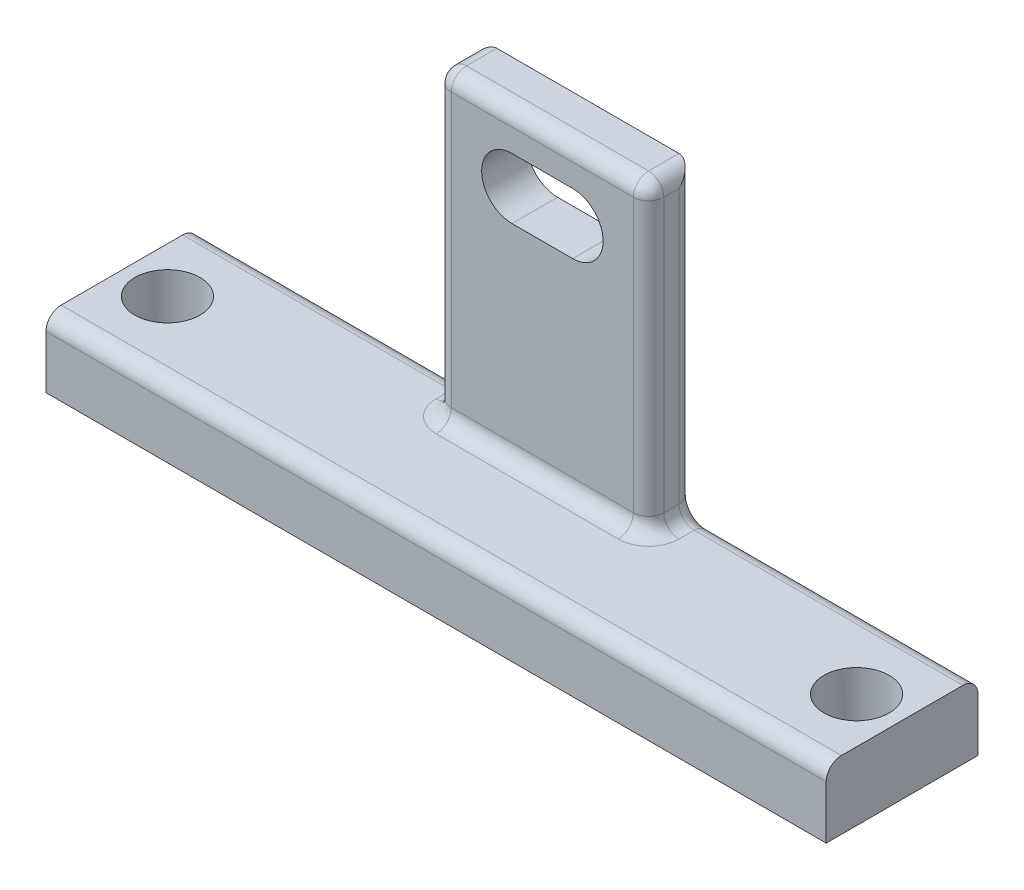
from build123d import *

# Parameters (mm, degrees)
SKETCH1_W               = 51.4
SKETCH1_H               = 4.5
BOSS_EXTRUDE1_DEPTH     = 10
CUT_EXTRUDE1_DEPTH      = 47.230988755
CUT_EXTRUDE1_DEPTH_BACK = 47.230988755
SKETCH2_R               = 2.15
SKETCH3_W               = 14
SKETCH3_H               = 3
BOSS_EXTRUDE2_DEPTH     = 20
CUT_EXTRUDE2_DEPTH      = 20
FILLET1_R               = 1


with BuildPart() as part:
    # Sketch1 → Boss-Extrude1 (new body)
    with BuildSketch(Plane.XY):
        with Locations((19.211627907, 1.395348837)):
            Rectangle(SKETCH1_W, SKETCH1_H)
    extrude(amount=BOSS_EXTRUDE1_DEPTH)

    # Sketch2 → Cut-Extrude1 (cut, two sides: drawn at the far end of the back side and taken through both)
    with BuildSketch(Plane(origin=(0, 3.645348837, 0), x_dir=(1, 0, 0), z_dir=(0, 1, 0)).offset(-CUT_EXTRUDE1_DEPTH_BACK)):
        with Locations(Location((-3.488372093, -5, 0), (0, 0, 270))):
            Circle(SKETCH2_R)
        with Locations(Location((41.911627907, -5, 0), (0, 0, 270))):
            Circle(SKETCH2_R)
    extrude(amount=CUT_EXTRUDE1_DEPTH + CUT_EXTRUDE1_DEPTH_BACK, mode=Mode.SUBTRACT)

    # Sketch3 → Boss-Extrude2 (add)
    with BuildSketch(Plane(origin=(0, 3.645348837, 0), x_dir=(1, 0, 0), z_dir=(0, 1, 0))):
        with Locations((19.211627907, -1.5)):
            Rectangle(SKETCH3_W, SKETCH3_H)
    extrude(amount=BOSS_EXTRUDE2_DEPTH)

    # Sketch4 → Cut-Extrude2 (cut)
    with BuildSketch(Plane.XY.offset(3)):
        with BuildLine():
            Line((17.211627907, 21.145348837), (21.211627907, 21.145348837))
            ThreePointArc((21.211627907, 21.145348837), (23.211627907, 19.145348837), (21.211627907, 17.145348837))
            Line((21.211627907, 17.145348837), (17.211627907, 17.145348837))
            ThreePointArc((17.211627907, 17.145348837), (15.211627907, 19.145348837), (17.211627907, 21.145348837))
        make_face()
    extrude(amount=-CUT_EXTRUDE2_DEPTH, mode=Mode.SUBTRACT)

    # Fillet1
    fillet1_edges = [part.edges().sort_by_distance(p)[0] for p in [
        (19.211627907, 3.645348837, 10),
        (2.861627907, 3.645348837, 0),
        (12.211627907, 3.645348837, 1.5),
        (12.211627907, 13.645348837, 0),
        (19.211627907, 3.645348837, 3),
        (12.211627907, 13.645348837, 3),
        (26.211627907, 3.645348837, 1.5),
        (26.211627907, 13.645348837, 3),
        (26.211627907, 13.645348837, 0),
        (12.211627907, 23.645348837, 1.5),
        (19.211627907, 23.645348837, 3),
        (26.211627907, 23.645348837, 1.5),
        (35.561627907, 3.645348837, 0),
    ]]
    fillet(fillet1_edges, radius=FILLET1_R)


solid = part.part
